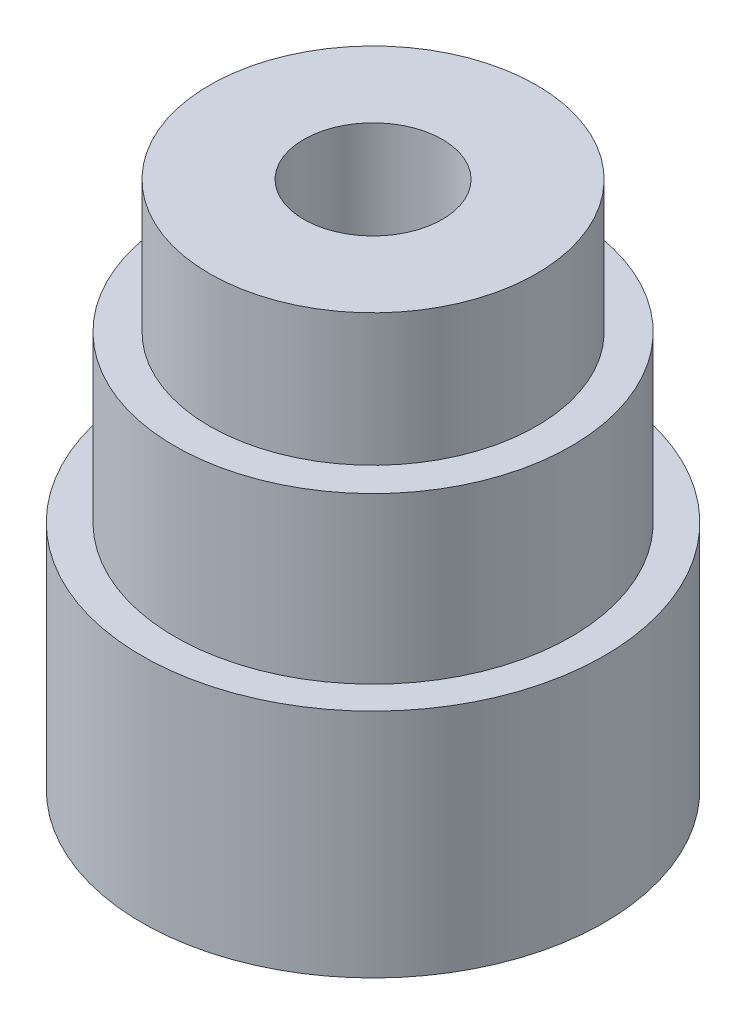
from build123d import *

# Parameters (mm, degrees)
SKETCH_2_R          = 2.1
CUT_EXTRUDE_1_DEPTH = 19


with BuildPart() as part:
    # 草图1 → 旋转1 (revolve)
    with BuildSketch(Plane.XY, mode=Mode.PRIVATE) as revolve_1_sk:
        Polygon((0, 0), (0, 16), (-4.95, 16), (-4.95, 12), (-6, 12), (-6, 7), (-7, 7), (-7, 0), align=None)
    revolve(revolve_1_sk.sketch.rotate(Axis((0, 0, 0), (0, 1, 0)), 270), axis=Axis((0, 0, 0), (0, 1, 0)))

    # 草图2 → 切除-拉伸1 (cut)
    with BuildSketch(Plane(origin=(0, 16, 0), x_dir=(1, 0, 0), z_dir=(0, 1, 0))):
        with Locations(Location((0, 0, 0), (0, 0, 180))):
            Circle(SKETCH_2_R)
    extrude(amount=-CUT_EXTRUDE_1_DEPTH, mode=Mode.SUBTRACT)


solid = part.part
